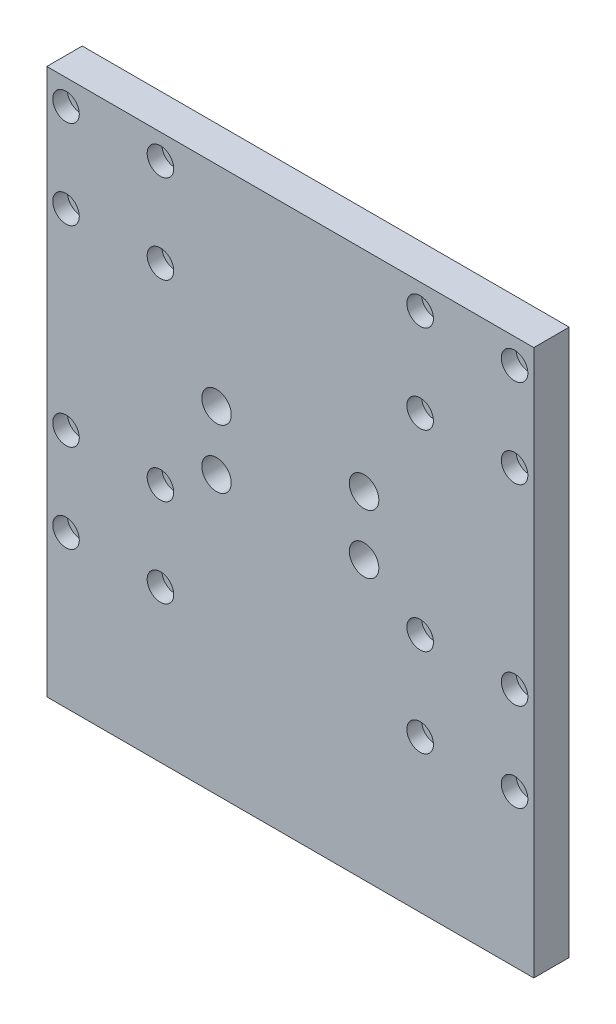
from build123d import *

# Parameters (mm, degrees)
ESQUISSE1_W             = 165
ESQUISSE1_H             = 140
BOSS_EXTRU_1_DEPTH      = 12
ESQUISSE2_W             = 72
ESQUISSE2_H             = 65
ENL_V_MAT_EXTRU_1_DEPTH = 4.5
ENL_V_MAT_EXTRU_2_REACH = 218.723
ESQUISSE3_R             = 2.5
ESQUISSE4_R             = 4.5
ENL_V_MAT_EXTRU_3_DEPTH = 5
ESQUISSE5_W             = 165
ESQUISSE5_H             = 12
BOSS_EXTRU_2_DEPTH      = 45
ENL_V_MAT_EXTRU_4_REACH = 218.521
ESQUISSE6_R             = 5


with BuildPart() as part:
    # Esquisse1 → Boss.-Extru.1 (new body)
    with BuildSketch(Plane.XY):
        with Locations((82.5, 70)):
            Rectangle(ESQUISSE1_W, ESQUISSE1_H)
    extrude(amount=BOSS_EXTRU_1_DEPTH)

    # Esquisse2 → Enlèv. mat.-Extru.1 (cut)
    with BuildSketch(Plane(origin=(0, 0, 0), x_dir=(-1, 0, 0), z_dir=(0, 0, -1))):
        with Locations((-82.5, 70.5)):
            Rectangle(ESQUISSE2_W, ESQUISSE2_H)
    extrude(amount=-ENL_V_MAT_EXTRU_1_DEPTH, mode=Mode.SUBTRACT)

    # Esquisse3 → Enlèv. mat.-Extru.2 (cut, up to next)
    with BuildSketch(Plane.XY.offset(12), mode=Mode.PRIVATE) as enl_v_mat_extru_2_sk1:
        with Locations((158.5, 6.5)):
            Circle(ESQUISSE3_R)
    enl_v_mat_extru_2_tool1 = extrude(enl_v_mat_extru_2_sk1.sketch, amount=-ENL_V_MAT_EXTRU_2_REACH, mode=Mode.PRIVATE) & part.part
    # Esquisse3 → Enlèv. mat.-Extru.2 (cut, up to next)
    with BuildSketch(Plane.XY.offset(12), mode=Mode.PRIVATE) as enl_v_mat_extru_2_sk2:
        with Locations((158.5, 131.5)):
            Circle(ESQUISSE3_R)
    enl_v_mat_extru_2_tool2 = extrude(enl_v_mat_extru_2_sk2.sketch, amount=-ENL_V_MAT_EXTRU_2_REACH, mode=Mode.PRIVATE) & part.part
    # Esquisse3 → Enlèv. mat.-Extru.2 (cut, up to next)
    with BuildSketch(Plane.XY.offset(12), mode=Mode.PRIVATE) as enl_v_mat_extru_2_sk3:
        with Locations((126.5, 6.5)):
            Circle(ESQUISSE3_R)
    enl_v_mat_extru_2_tool3 = extrude(enl_v_mat_extru_2_sk3.sketch, amount=-ENL_V_MAT_EXTRU_2_REACH, mode=Mode.PRIVATE) & part.part
    # Esquisse3 → Enlèv. mat.-Extru.2 (cut, up to next)
    with BuildSketch(Plane.XY.offset(12), mode=Mode.PRIVATE) as enl_v_mat_extru_2_sk4:
        with Locations((126.5, 36.5)):
            Circle(ESQUISSE3_R)
    enl_v_mat_extru_2_tool4 = extrude(enl_v_mat_extru_2_sk4.sketch, amount=-ENL_V_MAT_EXTRU_2_REACH, mode=Mode.PRIVATE) & part.part
    # Esquisse3 → Enlèv. mat.-Extru.2 (cut, up to next)
    with BuildSketch(Plane.XY.offset(12), mode=Mode.PRIVATE) as enl_v_mat_extru_2_sk5:
        with Locations((158.5, 36.5)):
            Circle(ESQUISSE3_R)
    enl_v_mat_extru_2_tool5 = extrude(enl_v_mat_extru_2_sk5.sketch, amount=-ENL_V_MAT_EXTRU_2_REACH, mode=Mode.PRIVATE) & part.part
    # Esquisse3 → Enlèv. mat.-Extru.2 (cut, up to next)
    with BuildSketch(Plane.XY.offset(12), mode=Mode.PRIVATE) as enl_v_mat_extru_2_sk6:
        with Locations((126.5, 131.5)):
            Circle(ESQUISSE3_R)
    enl_v_mat_extru_2_tool6 = extrude(enl_v_mat_extru_2_sk6.sketch, amount=-ENL_V_MAT_EXTRU_2_REACH, mode=Mode.PRIVATE) & part.part
    # Esquisse3 → Enlèv. mat.-Extru.2 (cut, up to next)
    with BuildSketch(Plane.XY.offset(12), mode=Mode.PRIVATE) as enl_v_mat_extru_2_sk7:
        with Locations((126.5, 101.5)):
            Circle(ESQUISSE3_R)
    enl_v_mat_extru_2_tool7 = extrude(enl_v_mat_extru_2_sk7.sketch, amount=-ENL_V_MAT_EXTRU_2_REACH, mode=Mode.PRIVATE) & part.part
    # Esquisse3 → Enlèv. mat.-Extru.2 (cut, up to next)
    with BuildSketch(Plane.XY.offset(12), mode=Mode.PRIVATE) as enl_v_mat_extru_2_sk8:
        with Locations((158.5, 101.5)):
            Circle(ESQUISSE3_R)
    enl_v_mat_extru_2_tool8 = extrude(enl_v_mat_extru_2_sk8.sketch, amount=-ENL_V_MAT_EXTRU_2_REACH, mode=Mode.PRIVATE) & part.part
    # Esquisse3 → Enlèv. mat.-Extru.2 (cut, up to next)
    with BuildSketch(Plane.XY.offset(12), mode=Mode.PRIVATE) as enl_v_mat_extru_2_sk9:
        with Locations(Location((6.5, 6.5, 0), (0, 0, 180))):
            Circle(ESQUISSE3_R)
    enl_v_mat_extru_2_tool9 = extrude(enl_v_mat_extru_2_sk9.sketch, amount=-ENL_V_MAT_EXTRU_2_REACH, mode=Mode.PRIVATE) & part.part
    # Esquisse3 → Enlèv. mat.-Extru.2 (cut, up to next)
    with BuildSketch(Plane.XY.offset(12), mode=Mode.PRIVATE) as enl_v_mat_extru_2_sk10:
        with Locations(Location((6.5, 36.5, 0), (0, 0, 180))):
            Circle(ESQUISSE3_R)
    enl_v_mat_extru_2_tool10 = extrude(enl_v_mat_extru_2_sk10.sketch, amount=-ENL_V_MAT_EXTRU_2_REACH, mode=Mode.PRIVATE) & part.part
    # Esquisse3 → Enlèv. mat.-Extru.2 (cut, up to next)
    with BuildSketch(Plane.XY.offset(12), mode=Mode.PRIVATE) as enl_v_mat_extru_2_sk11:
        with Locations(Location((38.5, 6.5, 0), (0, 0, 180))):
            Circle(ESQUISSE3_R)
    enl_v_mat_extru_2_tool11 = extrude(enl_v_mat_extru_2_sk11.sketch, amount=-ENL_V_MAT_EXTRU_2_REACH, mode=Mode.PRIVATE) & part.part
    # Esquisse3 → Enlèv. mat.-Extru.2 (cut, up to next)
    with BuildSketch(Plane.XY.offset(12), mode=Mode.PRIVATE) as enl_v_mat_extru_2_sk12:
        with Locations(Location((38.5, 36.5, 0), (0, 0, 180))):
            Circle(ESQUISSE3_R)
    enl_v_mat_extru_2_tool12 = extrude(enl_v_mat_extru_2_sk12.sketch, amount=-ENL_V_MAT_EXTRU_2_REACH, mode=Mode.PRIVATE) & part.part
    # Esquisse3 → Enlèv. mat.-Extru.2 (cut, up to next)
    with BuildSketch(Plane.XY.offset(12), mode=Mode.PRIVATE) as enl_v_mat_extru_2_sk13:
        with Locations(Location((6.5, 101.5, 0), (0, 0, 180))):
            Circle(ESQUISSE3_R)
    enl_v_mat_extru_2_tool13 = extrude(enl_v_mat_extru_2_sk13.sketch, amount=-ENL_V_MAT_EXTRU_2_REACH, mode=Mode.PRIVATE) & part.part
    # Esquisse3 → Enlèv. mat.-Extru.2 (cut, up to next)
    with BuildSketch(Plane.XY.offset(12), mode=Mode.PRIVATE) as enl_v_mat_extru_2_sk14:
        with Locations(Location((38.5, 101.5, 0), (0, 0, 180))):
            Circle(ESQUISSE3_R)
    enl_v_mat_extru_2_tool14 = extrude(enl_v_mat_extru_2_sk14.sketch, amount=-ENL_V_MAT_EXTRU_2_REACH, mode=Mode.PRIVATE) & part.part
    # Esquisse3 → Enlèv. mat.-Extru.2 (cut, up to next)
    with BuildSketch(Plane.XY.offset(12), mode=Mode.PRIVATE) as enl_v_mat_extru_2_sk15:
        with Locations(Location((38.5, 131.5, 0), (0, 0, 180))):
            Circle(ESQUISSE3_R)
    enl_v_mat_extru_2_tool15 = extrude(enl_v_mat_extru_2_sk15.sketch, amount=-ENL_V_MAT_EXTRU_2_REACH, mode=Mode.PRIVATE) & part.part
    # Esquisse3 → Enlèv. mat.-Extru.2 (cut, up to next)
    with BuildSketch(Plane.XY.offset(12), mode=Mode.PRIVATE) as enl_v_mat_extru_2_sk16:
        with Locations(Location((6.5, 131.5, 0), (0, 0, 180))):
            Circle(ESQUISSE3_R)
    enl_v_mat_extru_2_tool16 = extrude(enl_v_mat_extru_2_sk16.sketch, amount=-ENL_V_MAT_EXTRU_2_REACH, mode=Mode.PRIVATE) & part.part
    add(enl_v_mat_extru_2_tool1.solids().sort_by_distance((158.5, 6.5, 12))[0], mode=Mode.SUBTRACT)
    add(enl_v_mat_extru_2_tool2.solids().sort_by_distance((158.5, 131.5, 12))[0], mode=Mode.SUBTRACT)
    add(enl_v_mat_extru_2_tool3.solids().sort_by_distance((126.5, 6.5, 12))[0], mode=Mode.SUBTRACT)
    add(enl_v_mat_extru_2_tool4.solids().sort_by_distance((126.5, 36.5, 12))[0], mode=Mode.SUBTRACT)
    add(enl_v_mat_extru_2_tool5.solids().sort_by_distance((158.5, 36.5, 12))[0], mode=Mode.SUBTRACT)
    add(enl_v_mat_extru_2_tool6.solids().sort_by_distance((126.5, 131.5, 12))[0], mode=Mode.SUBTRACT)
    add(enl_v_mat_extru_2_tool7.solids().sort_by_distance((126.5, 101.5, 12))[0], mode=Mode.SUBTRACT)
    add(enl_v_mat_extru_2_tool8.solids().sort_by_distance((158.5, 101.5, 12))[0], mode=Mode.SUBTRACT)
    add(enl_v_mat_extru_2_tool9.solids().sort_by_distance((6.5, 6.5, 12))[0], mode=Mode.SUBTRACT)
    add(enl_v_mat_extru_2_tool10.solids().sort_by_distance((6.5, 36.5, 12))[0], mode=Mode.SUBTRACT)
    add(enl_v_mat_extru_2_tool11.solids().sort_by_distance((38.5, 6.5, 12))[0], mode=Mode.SUBTRACT)
    add(enl_v_mat_extru_2_tool12.solids().sort_by_distance((38.5, 36.5, 12))[0], mode=Mode.SUBTRACT)
    add(enl_v_mat_extru_2_tool13.solids().sort_by_distance((6.5, 101.5, 12))[0], mode=Mode.SUBTRACT)
    add(enl_v_mat_extru_2_tool14.solids().sort_by_distance((38.5, 101.5, 12))[0], mode=Mode.SUBTRACT)
    add(enl_v_mat_extru_2_tool15.solids().sort_by_distance((38.5, 131.5, 12))[0], mode=Mode.SUBTRACT)
    add(enl_v_mat_extru_2_tool16.solids().sort_by_distance((6.5, 131.5, 12))[0], mode=Mode.SUBTRACT)

    # Esquisse4 → Enlèv. mat.-Extru.3 (cut)
    with BuildSketch(Plane.XY.offset(12)):
        with Locations((6.5, 131.5)):
            Circle(ESQUISSE4_R)
        with Locations((6.5, 101.5)):
            Circle(ESQUISSE4_R)
        with Locations((6.5, 36.5)):
            Circle(ESQUISSE4_R)
        with Locations((6.5, 6.5)):
            Circle(ESQUISSE4_R)
        with Locations((38.5, 6.5)):
            Circle(ESQUISSE4_R)
        with Locations((38.5, 36.5)):
            Circle(ESQUISSE4_R)
        with Locations((38.5, 101.5)):
            Circle(ESQUISSE4_R)
        with Locations((38.5, 131.5)):
            Circle(ESQUISSE4_R)
        with Locations(Location((158.5, 101.5, 0), (0, 0, 180))):
            Circle(ESQUISSE4_R)
        with Locations(Location((158.5, 131.5, 0), (0, 0, 180))):
            Circle(ESQUISSE4_R)
        with Locations(Location((126.5, 131.5, 0), (0, 0, 180))):
            Circle(ESQUISSE4_R)
        with Locations(Location((126.5, 101.5, 0), (0, 0, 180))):
            Circle(ESQUISSE4_R)
        with Locations(Location((126.5, 6.5, 0), (0, 0, 180))):
            Circle(ESQUISSE4_R)
        with Locations(Location((158.5, 6.5, 0), (0, 0, 180))):
            Circle(ESQUISSE4_R)
        with Locations(Location((158.5, 36.5, 0), (0, 0, 180))):
            Circle(ESQUISSE4_R)
        with Locations(Location((126.5, 36.5, 0), (0, 0, 180))):
            Circle(ESQUISSE4_R)
    extrude(amount=-ENL_V_MAT_EXTRU_3_DEPTH, mode=Mode.SUBTRACT)

    # Esquisse5 → Boss.-Extru.2 (add)
    with BuildSketch(Plane.XZ):
        with Locations((82.5, 6)):
            Rectangle(ESQUISSE5_W, ESQUISSE5_H)
    extrude(amount=BOSS_EXTRU_2_DEPTH)

    # Esquisse6 → Enlèv. mat.-Extru.4 (cut, up to next)
    with BuildSketch(Plane(origin=(0, 0, 4.5), x_dir=(-1, 0, 0), z_dir=(0, 0, -1)), mode=Mode.PRIVATE) as enl_v_mat_extru_4_sk1:
        with Locations((-57.5, 49)):
            Circle(ESQUISSE6_R)
    enl_v_mat_extru_4_tool1 = extrude(enl_v_mat_extru_4_sk1.sketch, amount=-ENL_V_MAT_EXTRU_4_REACH, mode=Mode.PRIVATE) & part.part
    # Esquisse6 → Enlèv. mat.-Extru.4 (cut, up to next)
    with BuildSketch(Plane(origin=(0, 0, 4.5), x_dir=(-1, 0, 0), z_dir=(0, 0, -1)), mode=Mode.PRIVATE) as enl_v_mat_extru_4_sk2:
        with Locations((-57.5, 69)):
            Circle(ESQUISSE6_R)
    enl_v_mat_extru_4_tool2 = extrude(enl_v_mat_extru_4_sk2.sketch, amount=-ENL_V_MAT_EXTRU_4_REACH, mode=Mode.PRIVATE) & part.part
    # Esquisse6 → Enlèv. mat.-Extru.4 (cut, up to next)
    with BuildSketch(Plane(origin=(0, 0, 4.5), x_dir=(-1, 0, 0), z_dir=(0, 0, -1)), mode=Mode.PRIVATE) as enl_v_mat_extru_4_sk3:
        with Locations((-107.5, 49)):
            Circle(ESQUISSE6_R)
    enl_v_mat_extru_4_tool3 = extrude(enl_v_mat_extru_4_sk3.sketch, amount=-ENL_V_MAT_EXTRU_4_REACH, mode=Mode.PRIVATE) & part.part
    # Esquisse6 → Enlèv. mat.-Extru.4 (cut, up to next)
    with BuildSketch(Plane(origin=(0, 0, 4.5), x_dir=(-1, 0, 0), z_dir=(0, 0, -1)), mode=Mode.PRIVATE) as enl_v_mat_extru_4_sk4:
        with Locations((-107.5, 69)):
            Circle(ESQUISSE6_R)
    enl_v_mat_extru_4_tool4 = extrude(enl_v_mat_extru_4_sk4.sketch, amount=-ENL_V_MAT_EXTRU_4_REACH, mode=Mode.PRIVATE) & part.part
    add(enl_v_mat_extru_4_tool1.solids().sort_by_distance((57.5, 49, 4.5))[0], mode=Mode.SUBTRACT)
    add(enl_v_mat_extru_4_tool2.solids().sort_by_distance((57.5, 69, 4.5))[0], mode=Mode.SUBTRACT)
    add(enl_v_mat_extru_4_tool3.solids().sort_by_distance((107.5, 49, 4.5))[0], mode=Mode.SUBTRACT)
    add(enl_v_mat_extru_4_tool4.solids().sort_by_distance((107.5, 69, 4.5))[0], mode=Mode.SUBTRACT)


solid = part.part
